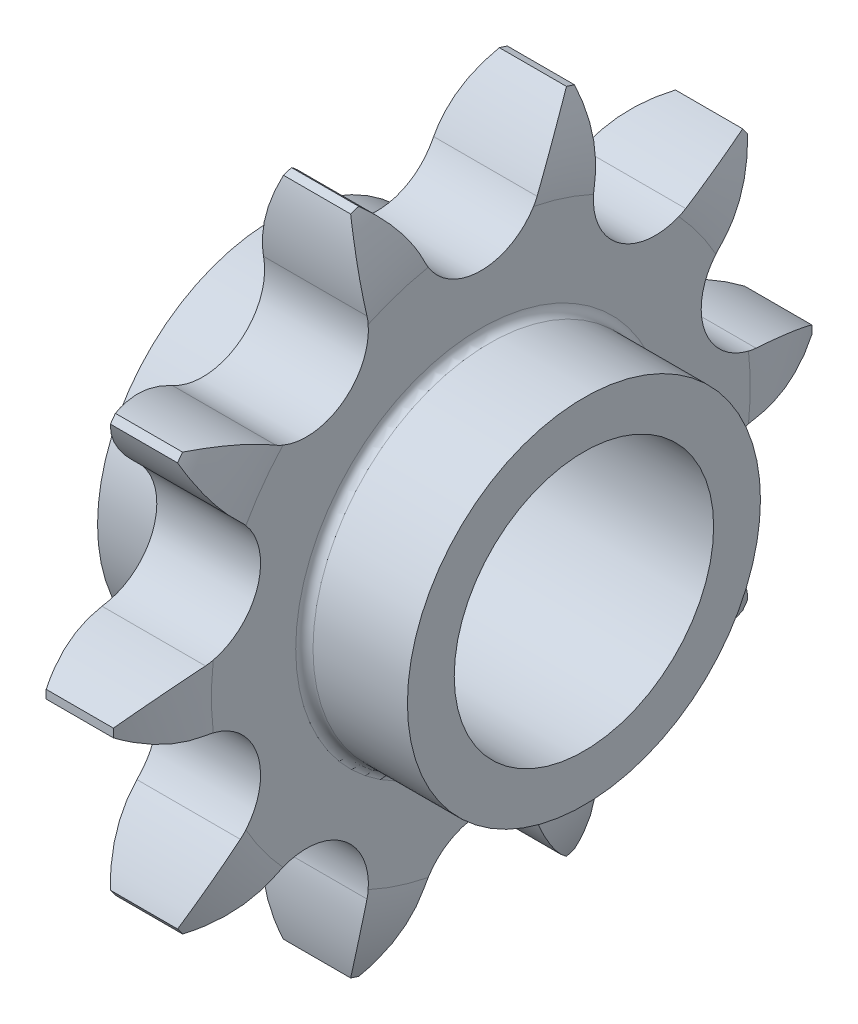
from build123d import *

# Parameters (mm, degrees)
TOOTHCUT_DEPTH      = 36.016771055
TEETHCUTS_COUNT     = 10
TEETHCUTS_ANGLE     = 324
HUBNEABOTSKE_R      = 12.248290485
HUBNEARBOTH_DEPTH   = 7.15025
HUBNEARBOTHFILLET_R = 0.6
HUBFAR_START        = 7.15025
HUBFARSKE_R         = 12.248290485
HUBFAR_DEPTH        = 7.15025
HUBFARFILLET_R      = 0.6
BORSKE_R            = 9
BORE_DEPTH          = 21.5005


with BuildPart() as part:
    # BasProSke → Base-Revolve (revolve)
    with BuildSketch(Plane(origin=(0, 0, 0), x_dir=(1, 0, 0), z_dir=(0, 1, 0)), mode=Mode.PRIVATE) as base_revolve_sk:
        with BuildLine():
            Line((0, 0), (0, 18.695730022))
            ThreePointArc((0, 18.695730022), (0.321571182, 21.535536353), (1.27, 24.23153168))
            Line((1.27, 24.23153168), (5.93, 24.23153168))
            ThreePointArc((5.93, 24.23153168), (6.878428818, 21.535536353), (7.2, 18.695730022))
            Line((7.2, 18.695730022), (7.2, 0))
            Line((7.2, 0), (0, 0))
        make_face()
    revolve(base_revolve_sk.sketch.rotate(Axis((-10, 0, 0), (1, 0, 0)), 180), axis=Axis((-10, 0, 0), (1, 0, 0)))

    # TooCutSke → ToothCut (cut, through all)
    with BuildSketch(Plane(origin=(0, 0, 0), x_dir=(0, 0, -1), z_dir=(1, 0, 0))):
        with BuildLine():
            ThreePointArc((3.91060406, 18.809416735), (5.501807162, 21.3944141), (7.679581337, 23.508991678))
            ThreePointArc((7.679581337, 23.508991678), (0, 24.73153168), (-7.679581337, 23.508991678))
            ThreePointArc((-7.679581337, 23.508991678), (-5.501807162, 21.3944141), (-3.91060406, 18.809416735))
            ThreePointArc((-3.91060406, 18.809416735), (0, 16.29403168), (3.91060406, 18.809416735))
        make_face()
    toothcut = extrude(amount=TOOTHCUT_DEPTH, mode=Mode.SUBTRACT)

    # TeethCuts: ToothCut ×10 about axis
    teethcuts_axis = Axis((-10, 0, 0), (1, 0, 0))
    for i in range(1, TEETHCUTS_COUNT):
        add(toothcut.rotate(teethcuts_axis, i * TEETHCUTS_ANGLE / (TEETHCUTS_COUNT - 1)), mode=Mode.SUBTRACT)

    # HubNeaBotSke → HubNearBoth (add)
    with BuildSketch(Plane.ZY):
        with Locations(Location((0, 0, 0), (0, 0, 180))):
            Circle(HUBNEABOTSKE_R)
    extrude(amount=HUBNEARBOTH_DEPTH)

    # HubNearBothFillet
    hubnearbothfillet_edges = [part.edges().sort_by_distance(p)[0] for p in [
        (0, 0, 12.248290485),
    ]]
    fillet(hubnearbothfillet_edges, radius=HUBNEARBOTHFILLET_R)

    # HubFarSke → HubFar (add)
    with BuildSketch(Plane(origin=(7.2, 0, 0), x_dir=(0, 0, -1), z_dir=(1, 0, 0)).offset(HUBFAR_START)):
        Circle(HUBFARSKE_R)
    extrude(amount=-HUBFAR_DEPTH)

    # HubFarFillet
    hubfarfillet_edges = [part.edges().sort_by_distance(p)[0] for p in [
        (7.2, 0, 12.248290485),
    ]]
    fillet(hubfarfillet_edges, radius=HUBFARFILLET_R)

    # BorSke → Bore (cut, symmetric)
    with BuildSketch(Plane(origin=(0, 0, 0), x_dir=(0, 0, -1), z_dir=(1, 0, 0))):
        with Locations(Location((0, 0, 0), (0, 0, 180))):
            Circle(BORSKE_R)
    extrude(amount=BORE_DEPTH, both=True, mode=Mode.SUBTRACT)


solid = part.part
